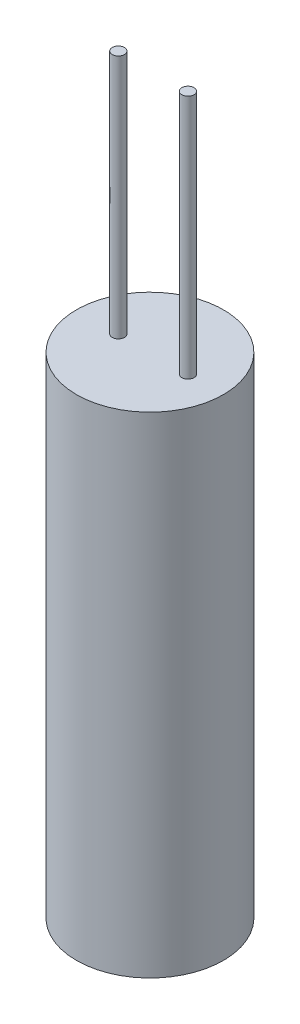
from build123d import *

# Parameters (mm, degrees)
SKETCH_1_R      = 3
EXTRUDE_1_DEPTH = 20
SKETCH_2_R      = 0.25
EXTRUDE_2_DEPTH = 10


with BuildPart() as part:
    # Эскиз1 → Бобышка-Вытянуть1 (new body)
    with BuildSketch(Plane(origin=(0, 0, 0), x_dir=(1, 0, 0), z_dir=(0, 1, 0))):
        with Locations(Location((0, 0, 0), (0, 0, 270))):
            Circle(SKETCH_1_R)
    extrude(amount=EXTRUDE_1_DEPTH)

    # Эскиз2 → Бобышка-Вытянуть2 (add)
    with BuildSketch(Plane(origin=(0, 20, 0), x_dir=(1, 0, 0), z_dir=(0, 1, 0))):
        with Locations(Location((-1.289652684, 0, 0), (0, 0, 270))):
            Circle(SKETCH_2_R)
        with Locations(Location((1.550347316, 0, 0), (0, 0, 270))):
            Circle(SKETCH_2_R)
    extrude(amount=EXTRUDE_2_DEPTH)


solid = part.part
